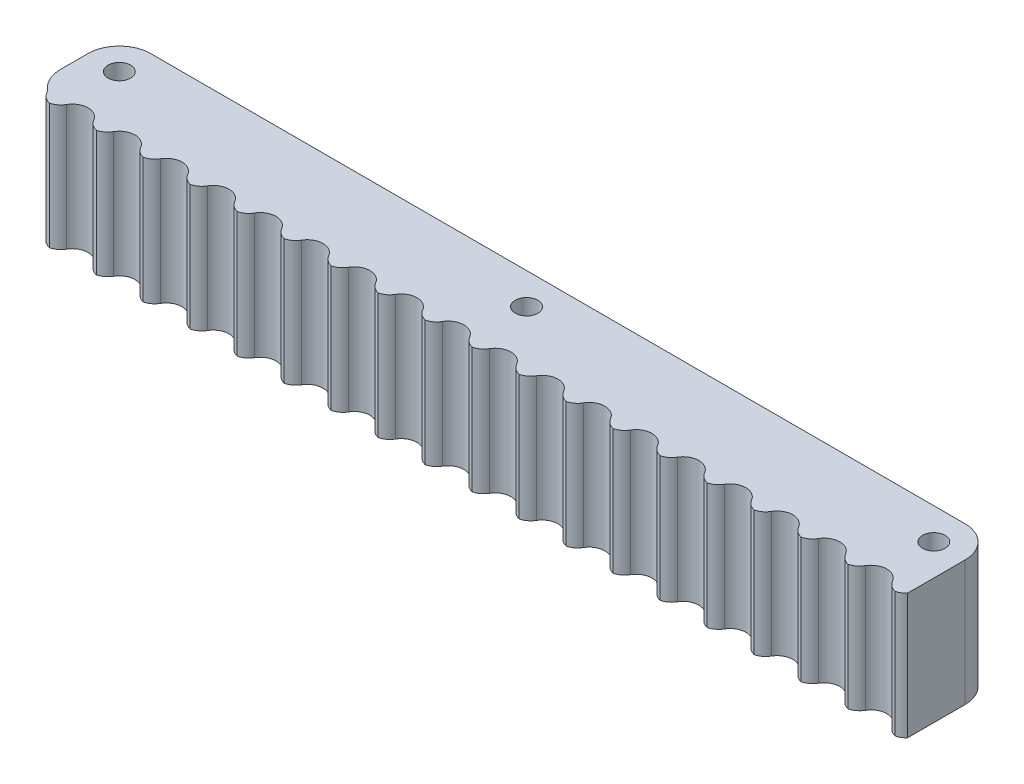
from build123d import *

# Parameters (mm, degrees)
SKETCH1_W           = 140
SKETCH1_H           = 15
BOSS_EXTRUDE1_DEPTH = 20
SKETCH2_R           = 1.8
CUT_EXTRUDE1_DEPTH  = 74.186405842
FILLET1_R           = 5
CUT_EXTRUDE2_DEPTH  = 74.186405842
LPATTERN1_COUNT     = 42
LPATTERN1_PITCH     = 7.5
FILLET2_R           = 5


with BuildPart() as part:
    # Sketch1 → Boss-Extrude1 (new body)
    with BuildSketch(Plane(origin=(0, 0, 0), x_dir=(1, 0, 0), z_dir=(0, 1, 0))):
        Rectangle(SKETCH1_W, SKETCH1_H)
    extrude(amount=BOSS_EXTRUDE1_DEPTH)

    # Sketch2 → Cut-Extrude1 (cut, through all)
    with BuildSketch(Plane(origin=(0, 20, 0), x_dir=(1, 0, 0), z_dir=(0, 1, 0))):
        with Locations(Location((-65, 2.5, 0), (0, 0, 270))):
            Circle(SKETCH2_R)
        with Locations(Location((0, 2.5, 0), (0, 0, 270))):
            Circle(SKETCH2_R)
        with Locations(Location((65, 2.5, 0), (0, 0, 270))):
            Circle(SKETCH2_R)
    extrude(amount=-CUT_EXTRUDE1_DEPTH, mode=Mode.SUBTRACT)

    # Fillet1
    fillet1_edges = [part.edges().sort_by_distance(p)[0] for p in [
        (-70, 10, -7.5),
        (70, 10, -7.5),
    ]]
    fillet(fillet1_edges, radius=FILLET1_R)

    # Sketch3 → Cut-Extrude2 (cut, through all)
    with BuildSketch(Plane(origin=(0, 20, 0), x_dir=(1, 0, 0), z_dir=(0, 1, 0))):
        with BuildLine():
            ThreePointArc((-67.834936491, -6.25), (-70, -5), (-72.165063509, -6.25))
            ThreePointArc((-72.165063509, -6.25), (-73.080127019, -7.165063509), (-74.330127019, -7.5))
            ThreePointArc((-74.330127019, -7.5), (-70, -11.830127019), (-65.669872981, -7.5))
            ThreePointArc((-65.669872981, -7.5), (-66.919872981, -7.165063509), (-67.834936491, -6.25))
        make_face()
    cut_extrude2 = extrude(amount=-CUT_EXTRUDE2_DEPTH, mode=Mode.SUBTRACT)

    # LPattern1: Cut-Extrude2 ×42
    with Locations(*[(i * LPATTERN1_PITCH, 0, 0) for i in range(1, LPATTERN1_COUNT)]):
        add(cut_extrude2, mode=Mode.SUBTRACT)

    # Fillet2
    fillet2_edges = [part.edges().sort_by_distance(p)[0] for p in [
        (-70, 10, 5),
    ]]
    fillet(fillet2_edges, radius=FILLET2_R)


solid = part.part
